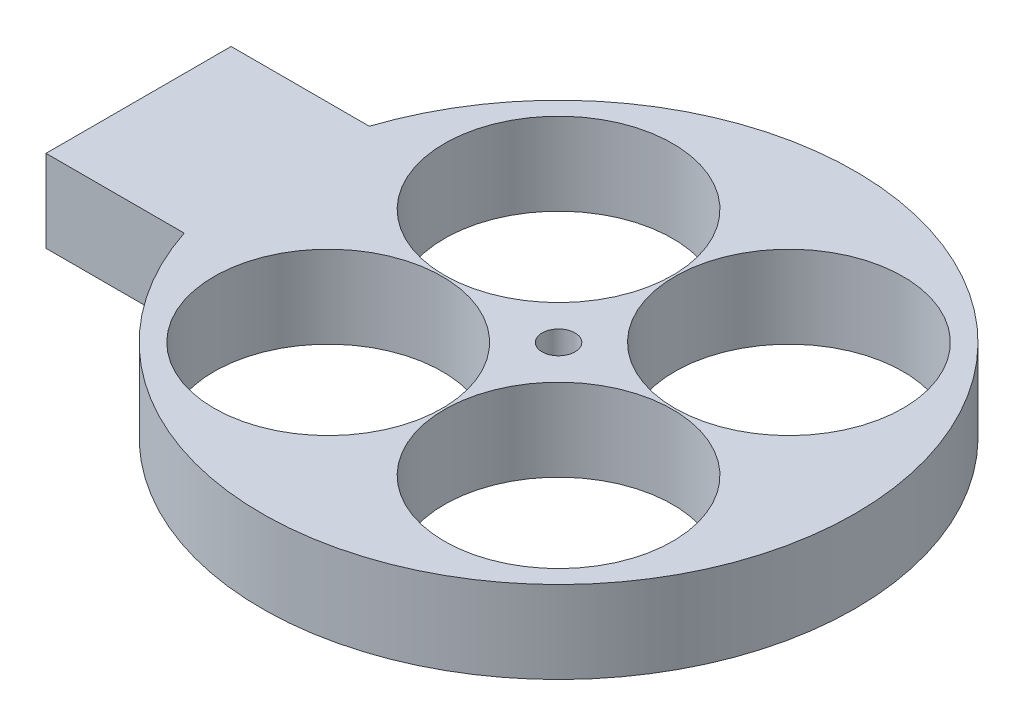
from build123d import *

# Parameters (mm, degrees)
SKETCH1_R           = 14.419595949
SKETCH1_R_2         = 5.55
SKETCH1_R_3         = 0.8
PLACA_CABEZAL_DEPTH = 4
SKETCH2_W           = 7.5
SKETCH2_H           = 9
PATA_AL_HUESO_DEPTH = 4


with BuildPart() as part:
    # Sketch1 → Placa_cabezal (new body)
    with BuildSketch(Plane(origin=(0, -2, 0), x_dir=(1, 0, 0), z_dir=(0, 1, 0))):
        with Locations(Location((0, 0, 0), (0, 0, 270))):
            Circle(SKETCH1_R)
        with Locations(Location((5.6, 5.6, 0), (0, 0, 270))):
            Circle(SKETCH1_R_2, mode=Mode.SUBTRACT)
        with Locations(Location((-5.6, 5.6, 0), (0, 0, 270))):
            Circle(SKETCH1_R_2, mode=Mode.SUBTRACT)
        with Locations(Location((-5.6, -5.6, 0), (0, 0, 270))):
            Circle(SKETCH1_R_2, mode=Mode.SUBTRACT)
        with Locations(Location((5.6, -5.6, 0), (0, 0, 270))):
            Circle(SKETCH1_R_2, mode=Mode.SUBTRACT)
        with Locations(Location((0, 0, 0), (0, 0, 270))):
            Circle(SKETCH1_R_3, mode=Mode.SUBTRACT)
    extrude(amount=PLACA_CABEZAL_DEPTH)

    # Sketch2 → Pata_al_hueso (add)
    with BuildSketch(Plane(origin=(0, -2, 0), x_dir=(1, 0, 0), z_dir=(0, 1, 0))):
        with Locations((-16.669595949, 0)):
            Rectangle(SKETCH2_W, SKETCH2_H)
    extrude(amount=PATA_AL_HUESO_DEPTH)


solid = part.part
